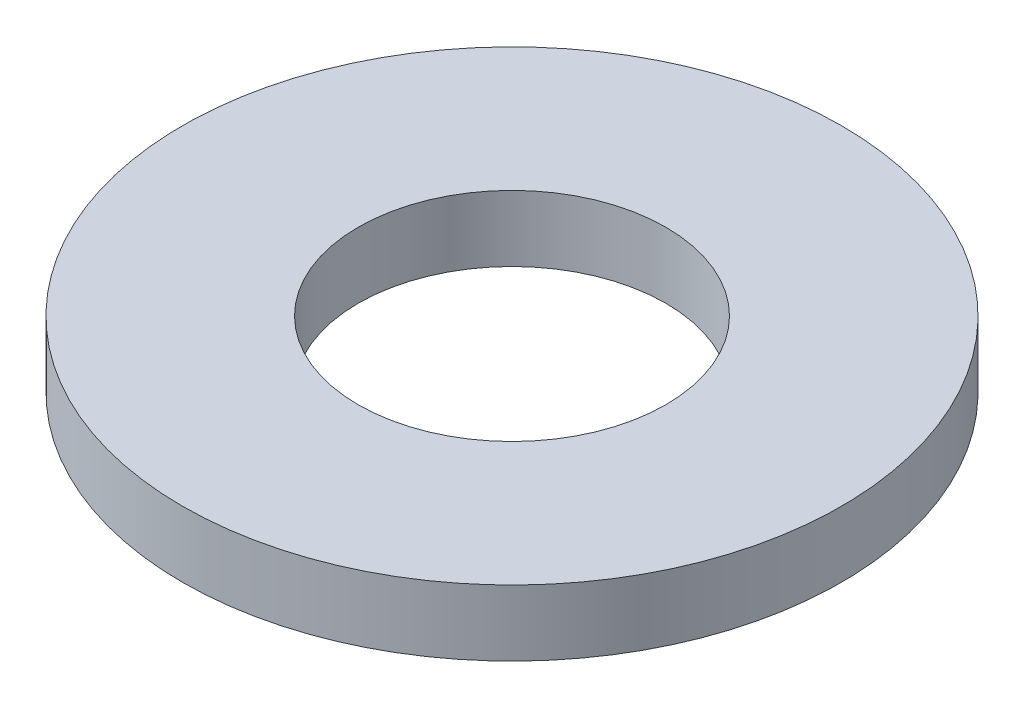
from build123d import *

# Parameters (mm, degrees)
SKETCH1_R           = 3.75
SKETCH1_R_2         = 1.75
BOSS_EXTRUDE1_DEPTH = 0.75


with BuildPart() as part:
    # Sketch1 → Boss-Extrude1 (new body)
    with BuildSketch(Plane(origin=(0, 0, 0), x_dir=(1, 0, 0), z_dir=(0, 1, 0))):
        with Locations(Location((0, 0, 0), (0, 0, 270))):
            Circle(SKETCH1_R)
        with Locations(Location((0, 0, 0), (0, 0, 270))):
            Circle(SKETCH1_R_2, mode=Mode.SUBTRACT)
    extrude(amount=BOSS_EXTRUDE1_DEPTH)


solid = part.part
